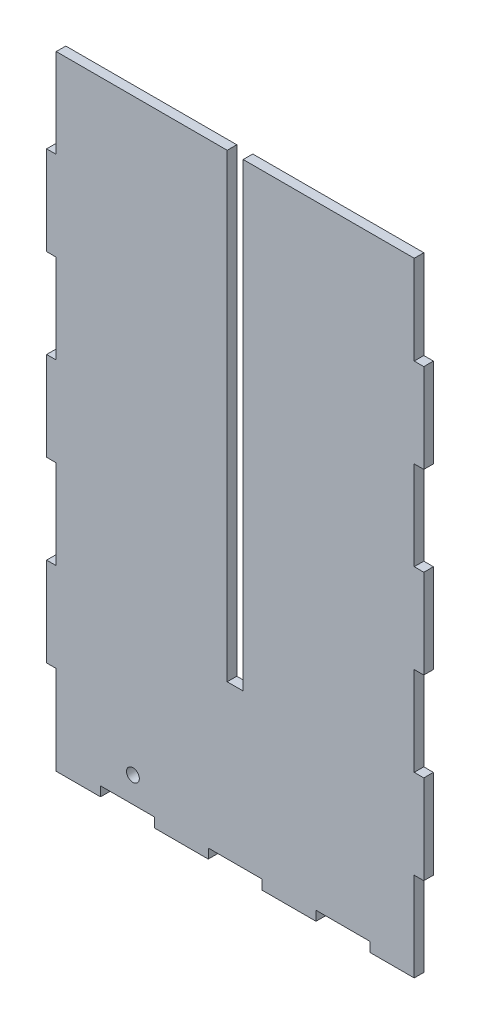
from build123d import *

# Parameters (mm, degrees)
SKETCH2_W           = 4.7625
SKETCH2_H           = 44.223214285
SKETCH2_H_2         = 44.223214286
SKETCH2_W_2         = 21.998214286
SKETCH2_H_3         = 4.7625
SKETCH2_W_3         = 26.760714286
BOSS_EXTRUDE1_DEPTH = 4.7625
SKETCH3_W           = 7.9375
SKETCH3_H           = 228.6
CUT_EXTRUDE1_DEPTH  = 184.017476539
SKETCH4_R           = 3.175
CUT_EXTRUDE2_DEPTH  = 184.017476539


with BuildPart() as part:
    # Sketch2 → Boss-Extrude1 (new body)
    with BuildSketch(Plane.XY):
        Polygon((0, -152.4), (0, 152.4), (-88.9, 152.4), (-88.9, 108.176785714), (-88.9, 63.953571429), (-88.9, 19.730357143), (-88.9, -24.492857143), (-88.9, -68.716071429), (-88.9, -112.939285714), (-88.9, -152.4), (-66.901785714, -152.4), (-40.141071429, -152.4), (-13.380357143, -152.4), align=None)
        Polygon((88.9, 152.4), (0, 152.4), (0, -152.4), (13.380357143, -152.4), (40.141071429, -152.4), (66.901785714, -152.4), (88.9, -152.4), (88.9, -112.939285714), (88.9, -68.716071429), (88.9, -24.492857143), (88.9, 19.730357143), (88.9, 63.953571429), (88.9, 108.176785714), align=None)
        with Locations((-91.28125, 86.065178572)):
            Rectangle(SKETCH2_W, SKETCH2_H)
        with Locations((-91.28125, -2.38125)):
            Rectangle(SKETCH2_W, SKETCH2_H_2)
        with Locations((-91.28125, -90.827678572)):
            Rectangle(SKETCH2_W, SKETCH2_H)
        with Locations((-77.900892857, -154.78125)):
            Rectangle(SKETCH2_W_2, SKETCH2_H_3)
        with Locations((-26.760714286, -154.78125)):
            Rectangle(SKETCH2_W_3, SKETCH2_H_3)
        with Locations((26.760714286, -154.78125)):
            Rectangle(SKETCH2_W_3, SKETCH2_H_3)
        with Locations((91.28125, -90.827678572)):
            Rectangle(SKETCH2_W, SKETCH2_H)
        with Locations((91.28125, -2.38125)):
            Rectangle(SKETCH2_W, SKETCH2_H_2)
        with Locations((91.28125, 86.065178572)):
            Rectangle(SKETCH2_W, SKETCH2_H)
        with Locations((77.900892857, -154.78125)):
            Rectangle(SKETCH2_W_2, SKETCH2_H_3)
    extrude(amount=BOSS_EXTRUDE1_DEPTH)

    # Sketch3 → Cut-Extrude1 (cut, through all)
    with BuildSketch(Plane.XY.offset(4.7625)):
        with Locations((0, 38.1)):
            Rectangle(SKETCH3_W, SKETCH3_H)
    extrude(amount=-CUT_EXTRUDE1_DEPTH, mode=Mode.SUBTRACT)

    # Sketch4 → Cut-Extrude2 (cut, through all)
    with BuildSketch(Plane.XY.offset(4.7625)):
        with Locations((-50.8, -139.7)):
            Circle(SKETCH4_R)
    extrude(amount=-CUT_EXTRUDE2_DEPTH, mode=Mode.SUBTRACT)


solid = part.part
